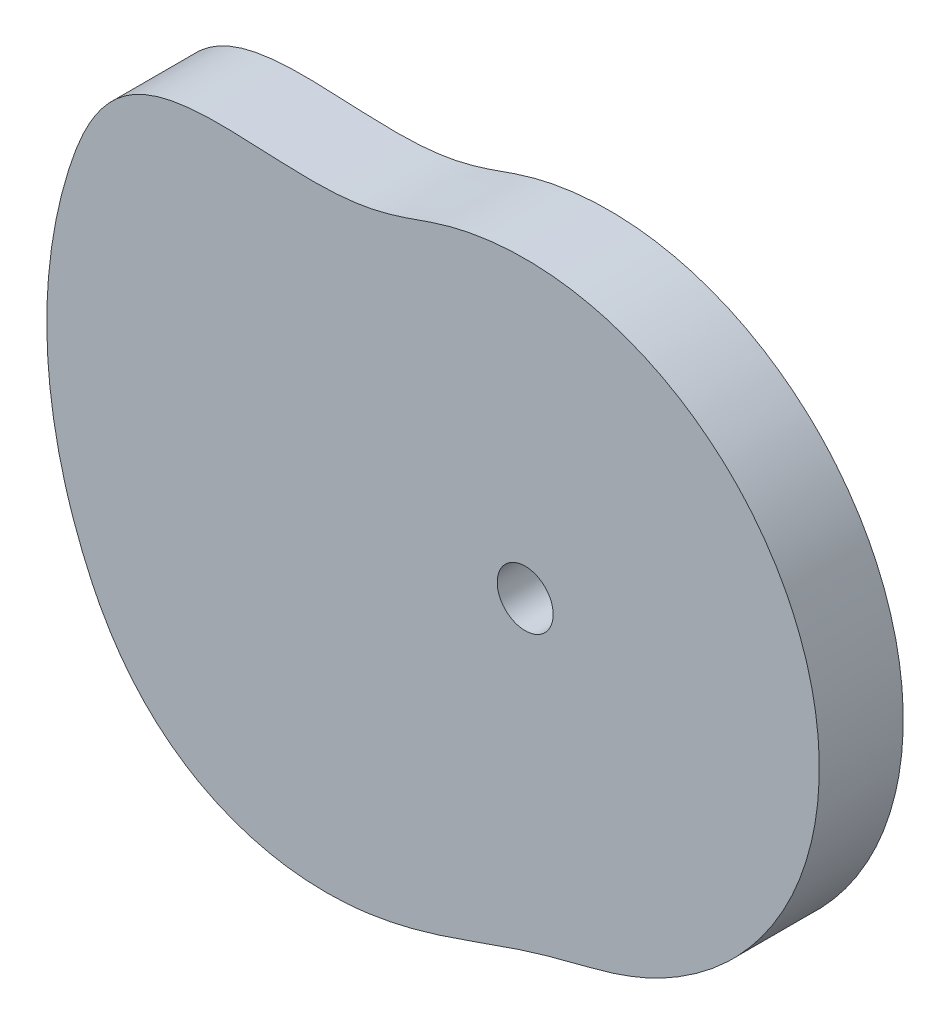
from build123d import *

# Parameters (mm, degrees)
EXTRUDE_1_DEPTH     = 30
SKETCH_2_R          = 10
CUT_EXTRUDE_1_DEPTH = 30


with BuildPart() as part:
    # 草图1 → 凸台-拉伸1 (new body)
    with BuildSketch(Plane.XY):
        with BuildLine():
            add(Edge.make_bspline(
                [(70.35, 78.08), (70.1235491, 78.280265016), (69.665997774, 78.682570689), (68.982412314, 79.289398371), (68.292102593, 79.893029744), (67.588891883, 80.478691495), (66.891717566, 81.072720617), (66.181496931, 81.652705568), (65.459176642, 82.218957625), (64.743004647, 82.790494133), (64.01804335, 83.351779204), (63.291324083, 83.912822246), (62.552523547, 84.4601179), (61.809219345, 84.998915226), (61.0715855, 85.543514417), (60.321667599, 86.069049698), (59.571364355, 86.593553293), (58.809377673, 87.09909109), (58.048095592, 87.612116201), (57.285135355, 88.121242025), (56.507988407, 88.612120666), (55.729281356, 89.098829125), (54.955443387, 89.592177693), (54.167309458, 90.061095985), (53.382581794, 90.53104426), (52.58761119, 90.991635477), (51.792381121, 91.450854376), (50.991804366, 91.899891345), (50.190566729, 92.343904103), (49.37903888, 92.76817937), (48.570838757, 93.204675043), (47.748827061, 93.617695569), (46.935230479, 94.043794382), (46.108915556, 94.437794631), (45.290395219, 94.844441046), (44.456874114, 95.230455735), (43.626772573, 95.620869203), (42.787424456, 95.991755272), (41.94930175, 96.358353036), (41.112163039, 96.736240473), (40.259124813, 97.077928819), (39.412073293, 97.431729794), (38.561840427, 97.77137982), (37.706792076, 98.100279549), (36.854002453, 98.434090717), (35.989554485, 98.738820067), (35.127021824, 99.050923678), (34.263749441, 99.364227648), (33.389415615, 99.648291177), (32.521638137, 99.941603822), (31.648853584, 100.223684253), (30.769363424, 100.487883128), (29.893405573, 100.764841077), (29.009691615, 101.008998847), (28.129648847, 101.258660452), (27.250300213, 101.516774036), (26.35920284, 101.736931047), (25.473003951, 101.975439133), (24.579648825, 102.178615573), (23.686803477, 102.390493025), (22.79561687, 102.603581625), (21.89653694, 102.789430586), (21.001167787, 102.98231536), (20.100828934, 103.160919096), (19.197912593, 103.33352972), (18.292911663, 103.4876295), (17.390981544, 103.652308396), (16.487565833, 103.802320098), (15.580690861, 103.941294768), (14.670774474, 104.072351441), (13.759841721, 104.188802075), (12.850722712, 104.31232647), (11.940548562, 104.421475455), (11.030499112, 104.521379028), (10.117248498, 104.613014207), (9.203173648, 104.688173463), (8.290485676, 104.77249157), (7.377020114, 104.841627407), (6.463659514, 104.902276814), (5.546584453, 104.9482015), (4.630552269, 105.006038959), (3.713240267, 105.027686041), (2.796848064, 105.062613859), (1.880074106, 105.082407798), (0.963328403, 105.087800086), (0.046664522, 105.106155687), (-0.869983848, 105.087507808), (-1.790116339, 105.083745054), (-2.706599831, 105.057600804), (-3.623764543, 105.046282484), (-4.539841905, 104.996483876), (-5.457449364, 104.967682321), (-6.372762096, 104.893697574), (-7.287509723, 104.856556381), (-8.200407894, 104.781171246), (-9.113194762, 104.69853182), (-10.027242858, 104.622918691), (-10.940500687, 104.531404942), (-11.850547885, 104.431467015), (-12.760723846, 104.322334284), (-13.66983786, 104.198779241), (-14.580788792, 104.082435001), (-15.490637331, 103.950982654), (-16.397765186, 103.813482371), (-17.302927761, 103.657548845), (-18.207820528, 103.513455268), (-19.110838419, 103.351191073), (-20.010909103, 103.181381942), (-20.911146301, 103.002191153), (-21.806542359, 102.809462502), (-22.705616408, 102.623576609), (-23.596799773, 102.41048053), (-24.489663895, 102.198669794), (-25.382947184, 101.995234052), (-26.269416046, 101.757701508), (-27.15863919, 101.534122817), (-28.04396715, 101.288942582), (-28.92868566, 101.043680441), (-29.806846958, 100.780579528), (-30.684293071, 100.51986696), (-31.558691703, 100.253110924), (-32.434352394, 99.969759705), (-33.31677594, 99.677041486), (-34.216631567, 99.382949848), (-35.124803612, 99.054626849), (-36.054780709, 98.740838338), (-36.997086637, 98.407847129), (-37.952630509, 98.06800766), (-38.930067034, 97.726857471), (-39.922671745, 97.378098927), (-40.932976269, 97.0289729), (-41.958200984, 96.674682446), (-43.003016412, 96.329028914), (-44.065767622, 95.97727824), (-45.144139376, 95.6253551), (-46.244574416, 95.286418145), (-47.364250227, 94.954870714), (-48.503636243, 94.641159123), (-49.652665429, 94.311655459), (-50.826975094, 94.021262383), (-52.008737323, 93.710752014), (-53.216968242, 93.451221883), (-54.433776674, 93.173165108), (-55.668233756, 92.927388126), (-56.918725226, 92.696267536), (-58.181554304, 92.475936886), (-59.461700787, 92.27551393), (-60.752736062, 92.098920014), (-62.0519496, 91.925482557), (-63.365533898, 91.775956129), (-64.692359191, 91.645772167), (-66.029653842, 91.538705745), (-67.376320938, 91.438853226), (-68.732372312, 91.342450169), (-70.103212576, 91.289703707), (-71.479813096, 91.237780082), (-72.866548173, 91.198895988), (-74.259839905, 91.165442573), (-75.663326141, 91.159170403), (-77.07335572, 91.157809781), (-78.493355558, 91.169702059), (-79.920283959, 91.183625089), (-81.353104473, 91.235971797), (-82.793705134, 91.25308565), (-84.239931927, 91.312374038), (-85.690207173, 91.35756618), (-87.146925885, 91.417673942), (-88.60634889, 91.493784841), (-90.073632638, 91.546594895), (-91.536641249, 91.620594753), (-93.00332265, 91.690218453), (-94.473348871, 91.759632833), (-95.94308858, 91.832195864), (-97.413345552, 91.889771732), (-98.880022297, 91.949380314), (-100.346440199, 92.012693181), (-101.810041739, 92.05894335), (-103.266505991, 92.11130087), (-104.716434191, 92.154955142), (-106.160032491, 92.168297693), (-107.59659747, 92.19176699), (-109.023336966, 92.204280077), (-110.440056875, 92.19109659), (-111.84341195, 92.171485016), (-113.236956104, 92.14380781), (-114.617153653, 92.094137888), (-115.98357305, 92.021050376), (-117.334081037, 91.944663061), (-118.664228942, 91.843989236), (-119.977689917, 91.723645144), (-121.27462726, 91.584450781), (-122.554791935, 91.424275436), (-123.811897294, 91.24572751), (-125.048379863, 91.043361184), (-126.262484875, 90.826320992), (-127.455577427, 90.584012893), (-128.627513957, 90.327653082), (-129.776272744, 90.03439506), (-130.903697096, 89.726345244), (-132.00883842, 89.397363951), (-133.087317257, 89.034788367), (-134.147771347, 88.655328437), (-135.185576718, 88.257281494), (-136.20284184, 87.834288594), (-137.201009372, 87.386372708), (-138.17736094, 86.907744964), (-139.131376176, 86.402080078), (-140.072663145, 85.886304286), (-140.993030276, 85.335547159), (-141.890652289, 84.754371092), (-142.775609832, 84.152729067), (-143.645350318, 83.521661552), (-144.501056955, 82.867270607), (-145.339432495, 82.177853952), (-146.162095011, 81.466840339), (-146.969778413, 80.716929722), (-147.763161627, 79.943173338), (-148.549321727, 79.138672244), (-149.317236856, 78.302288995), (-150.062767631, 77.42852956), (-150.810969479, 76.540847116), (-151.526184112, 75.607126748), (-152.236857214, 74.647413903), (-152.937795007, 73.659927279), (-153.616858245, 72.636600935), (-154.28586005, 71.585808062), (-154.950077249, 70.511799691), (-155.574168396, 69.392291524), (-156.206046161, 68.260238604), (-156.817653452, 67.097293282), (-157.406614444, 65.90480213), (-157.983451948, 64.686535618), (-158.559263727, 63.447093498), (-159.100403323, 62.17826038), (-159.649115168, 60.896480245), (-160.163531906, 59.585972274), (-160.673689741, 58.256015), (-161.177455933, 56.908399041), (-161.648761633, 55.536234141), (-162.137457635, 54.158130419), (-162.593519455, 52.755515498), (-163.040831792, 51.341315906), (-163.483327486, 49.918690675), (-163.909811695, 48.490953045), (-164.336550891, 47.060428382), (-164.726342709, 45.618995355), (-165.137724684, 44.184747098), (-165.498860452, 42.736344994), (-165.871562292, 41.291256019), (-166.233914949, 39.842542297), (-166.569848636, 38.390740691), (-166.90556492, 36.93935966), (-167.210326979, 35.48075316), (-167.513057572, 34.017958683), (-167.80016144, 32.554007292), (-168.082085868, 31.0876959), (-168.354002828, 29.621884599), (-168.600883744, 28.150693269), (-168.84208985, 26.677540826), (-169.073070968, 25.204785593), (-169.282034277, 23.72740213), (-169.480855371, 22.25056345), (-169.674418011, 20.771346378), (-169.840695048, 19.290442638), (-170.002749859, 17.807300867), (-170.150061368, 16.323672177), (-170.295066961, 14.837697511), (-170.410973411, 13.350317297), (-170.521099017, 11.860326383), (-170.624466568, 10.370670007), (-170.700840539, 8.880203183), (-170.772085741, 7.390235384), (-170.830759365, 5.900161476), (-170.884832054, 4.410302771), (-170.909873791, 2.920058087), (-170.935662328, 1.430079892), (-170.927474081, -0.060008571), (-170.934457389, -1.553378624), (-170.914637518, -3.046922389), (-170.867450249, -4.539923318), (-170.835657769, -6.030410618), (-170.769861046, -7.520143554), (-170.704827999, -9.010611603), (-170.610673803, -10.50026518), (-170.51256199, -11.987082803), (-170.40032115, -13.473610586), (-170.284423857, -14.960963462), (-170.141640036, -16.447166373), (-169.990986344, -17.930439472), (-169.834386486, -19.411271513), (-169.650772267, -20.890520426), (-169.462014345, -22.370705213), (-169.260658143, -23.85054383), (-169.055176709, -25.328431133), (-168.820877107, -26.800688181), (-168.581004149, -28.270708787), (-168.334203256, -29.741925653), (-168.060563284, -31.21073481), (-167.783029129, -32.677904073), (-167.490599541, -34.140790037), (-167.193901173, -35.60223867), (-166.872199668, -37.057916831), (-166.540709608, -38.510921782), (-166.203992838, -39.962575471), (-165.84038119, -41.410940145), (-165.473295257, -42.858388153), (-165.090218643, -44.300940892), (-164.704430096, -45.743086417), (-164.289379191, -47.176498166), (-163.883218042, -48.612872549), (-163.455293284, -50.040386678), (-162.997602502, -51.459238909), (-162.554059768, -52.883460006), (-162.082410486, -54.298617169), (-161.599996129, -55.711122966), (-161.11611909, -57.121228748), (-160.597306506, -58.519020344), (-160.094187323, -59.924026583), (-159.560988784, -61.318318553), (-159.026062488, -62.71173006), (-158.45710065, -64.088824657), (-157.905973159, -65.471893222), (-157.319898243, -66.8414014), (-156.733444583, -68.204820115), (-156.141729387, -69.56371359), (-155.534501369, -70.911832025), (-154.902429226, -72.244481888), (-154.272699016, -73.574543203), (-153.621140842, -74.88887929), (-152.967392894, -76.200587934), (-152.278437383, -77.490945022), (-151.594951933, -78.782993713), (-150.880771017, -80.058958265), (-150.167391238, -81.331486334), (-149.417932646, -82.580755497), (-148.677131108, -83.831779608), (-147.898803933, -85.063476444), (-147.116471388, -86.291940304), (-146.301259033, -87.499799209), (-145.482476337, -88.702974324), (-144.643284767, -89.896272411), (-143.771270392, -91.070117247), (-142.89458097, -92.239333506), (-142.002515136, -93.396574495), (-141.080753512, -94.532737404), (-140.1453977, -95.663584374), (-139.177219064, -96.77338349), (-138.207977751, -97.88321614), (-137.200347767, -98.963308031), (-136.180844334, -100.033896437), (-135.143920286, -101.093927598), (-134.080139624, -102.133723061), (-133.002842209, -103.163433174), (-131.902906948, -104.177781067), (-130.769428434, -105.159836104), (-129.632815405, -106.148573485), (-128.462247407, -107.100263322), (-127.281328088, -108.047840882), (-126.07164686, -108.964537857), (-124.838639357, -109.86400878), (-123.59552122, -110.752649853), (-122.329772794, -111.618038155), (-121.037712374, -112.453497526), (-119.735118129, -113.283572392), (-118.408621064, -114.087963377), (-117.061412128, -114.861655258), (-115.702678903, -115.627170957), (-114.319055287, -116.354406584), (-112.919722551, -117.066243107), (-111.500530599, -117.751321083), (-110.074047674, -118.430448871), (-108.617776666, -119.049323429), (-107.160893435, -119.678238924), (-105.682256602, -120.264544229), (-104.1903942, -120.823478717), (-102.687365187, -121.364742991), (-101.176354086, -121.885972058), (-99.646847153, -122.364907302), (-98.109395204, -122.822561727), (-96.562614013, -123.268663708), (-94.999039516, -123.663078213), (-93.43193939, -124.041322626), (-91.861607001, -124.409635445), (-90.281337944, -124.720194527), (-88.696713628, -125.02886422), (-87.104318609, -125.289321108), (-85.510038065, -125.549922967), (-83.910983885, -125.751579641), (-82.31112629, -125.943138366), (-80.71147429, -126.115076668), (-79.107898003, -126.256042155), (-77.503853337, -126.361791324), (-75.900754558, -126.455308899), (-74.303748933, -126.51645876), (-72.706725469, -126.538226901), (-71.113332828, -126.570907904), (-69.523272645, -126.538276856), (-67.939585058, -126.516442911), (-66.362527116, -126.45605407), (-64.79309368, -126.360509284), (-63.229314213, -126.26339583), (-61.671943007, -126.14606059), (-60.122189141, -125.994068214), (-58.582960522, -125.820166891), (-57.051017856, -125.648086281), (-55.532837286, -125.430028824), (-54.024798651, -125.215677355), (-52.528292286, -124.973354188), (-51.042581095, -124.710977964), (-49.564096717, -124.446775601), (-48.099489051, -124.149221874), (-46.643638101, -123.857485448), (-45.206734563, -123.529669885), (-43.777385126, -123.21461612), (-42.365310716, -122.872223858), (-40.960068768, -122.52595367), (-39.573622373, -122.14890876), (-38.194094121, -121.78605798), (-36.833672324, -121.398817674), (-35.479488044, -121.026599911), (-34.143565968, -120.619185579), (-32.81106181, -120.224116162), (-31.496138021, -119.811682269), (-30.191059188, -119.403768409), (-28.903086869, -118.980739135), (-27.622727134, -118.561841311), (-26.353067885, -118.140810041), (-25.091011197, -117.723531438), (-23.84568917, -117.29279943), (-22.609848729, -116.860439831), (-21.384862044, -116.428930531), (-20.160705233, -116.014190742), (-18.952812747, -115.581439335), (-17.754656678, -115.149617185), (-16.562562475, -114.732171933), (-15.379847898, -114.310430056), (-14.205008207, -113.888600375), (-13.030123755, -113.485683461), (-11.876879444, -113.056680902), (-10.71966463, -112.660935235), (-9.572517157, -112.262349138), (-8.432077882, -111.85733443), (-7.292342625, -111.472873068), (-6.164457783, -111.080070018), (-5.041822133, -110.697872175), (-3.922297574, -110.33312683), (-2.811996938, -109.957263238), (-1.699634248, -109.601114503), (-0.594443381, -109.239898904), (0.505490021, -108.889571665), (1.600561076, -108.551840225), (2.683384554, -108.205860728), (3.772460513, -107.894845312), (4.843420061, -107.555767049), (5.920596318, -107.25202161), (6.985334364, -106.938693584), (8.050329258, -106.641158857), (9.10542933, -106.338911434), (10.16026178, -106.050940876), (11.205618128, -105.759506075), (12.245695599, -105.479663013), (13.28005521, -105.210210685), (14.307019459, -104.941338545), (15.330047747, -104.67018307), (16.342624875, -104.400631459), (17.353187867, -104.139438953), (18.352379003, -103.879602147), (19.351799261, -103.63364814), (20.335064707, -103.367151955), (21.31889977, -103.125209636), (22.285334634, -102.858274594), (23.249910758, -102.609681097), (24.208789836, -102.364602396), (25.155040774, -102.097312578), (26.098889849, -101.854817987), (27.026556447, -101.589602225), (27.951901339, -101.333255556), (28.861929016, -101.058556101), (29.77380329, -100.806007282), (30.664667778, -100.516798719), (31.556330061, -100.256301651), (32.434109378, -99.968973809), (33.304067503, -99.682274823), (34.176639288, -99.392830689), (35.034624707, -99.077545322), (35.903937134, -98.784315278), (36.761601941, -98.460815458), (37.61947571, -98.128680359), (38.479827448, -97.804702921), (39.328916891, -97.457338022), (40.182265106, -97.126850581), (41.021411001, -96.755434991), (41.869733688, -96.403833826), (42.709766719, -96.03351518), (43.541678658, -95.646365657), (44.37983942, -95.273595898), (45.209932831, -94.883433797), (46.029073197, -94.478128415), (46.855060172, -94.083462029), (47.669354818, -93.658698731), (48.487524304, -93.241709487), (49.304861823, -92.822479023), (50.107149629, -92.380868667), (50.912743862, -91.941600868), (51.709215887, -91.488609445), (52.510719269, -91.043760703), (53.301843765, -90.579784699), (54.092510888, -90.110837306), (54.877441019, -89.631285277), (55.661291864, -89.154041589), (56.428693484, -88.65796106), (57.206126504, -88.172765798), (57.964281833, -87.659714593), (58.735900881, -87.16214712), (59.48759208, -86.641312772), (60.242551355, -86.120330044), (60.9924934, -85.590146689), (61.737872522, -85.051681642), (62.48171442, -84.513468136), (63.209193762, -83.958916846), (63.942575212, -83.410075368), (64.671306019, -82.852613458), (65.392228671, -82.279448269), (66.108678119, -81.702481069), (66.818612986, -81.122367578), (67.522594619, -80.539768901), (68.222155464, -79.949209678), (68.92169136, -79.352446907), (69.609139544, -78.742749114), (70.288526103, -78.12839779), (70.976453576, -77.523972851), (71.634599345, -76.887544321), (72.316597058, -76.273829906), (72.968340493, -75.628254526), (73.629859404, -74.993279099), (74.281937568, -74.348623595), (74.93239403, -73.702307352), (75.568726249, -73.041975399), (76.203191486, -72.379683342), (76.82854229, -71.708648359), (77.462868733, -71.045437998), (78.07189243, -70.358316926), (78.67974441, -69.669779719), (79.289319365, -68.982342318), (79.893050878, -68.292121316), (80.478685829, -67.588886864), (81.072722137, -66.891718913), (81.65270516, -66.181496569), (82.218957734, -65.459176739), (82.790494103, -64.743004621), (83.351779212, -64.018043357), (83.912822244, -63.291324081), (84.460117901, -62.552523548), (84.998915226, -61.809219345), (85.543514417, -61.0715855), (86.069049698, -60.321667599), (86.593553293, -59.571364355), (87.09909109, -58.809377673), (87.612116201, -58.048095592), (88.121242025, -57.285135355), (88.612120666, -56.507988407), (89.098829125, -55.729281356), (89.592177693, -54.955443387), (90.061095985, -54.167309458), (90.53104426, -53.382581794), (90.991635477, -52.58761119), (91.450854376, -51.792381121), (91.899891345, -50.991804366), (92.343904103, -50.190566729), (92.76817937, -49.37903888), (93.204675043, -48.570838757), (93.617695569, -47.748827061), (94.043794382, -46.935230479), (94.437794631, -46.108915556), (94.844441045, -45.290395218), (95.230455738, -44.456874115), (95.620869192, -43.626772569), (95.991755311, -42.78742447), (96.358352889, -41.949301697), (96.73624102, -41.112163235), (97.077926776, -40.25912408), (97.431737403, -39.412076021), (97.771351599, -38.561830311), (98.100384871, -37.706829828), (98.433694388, -36.853860391), (98.741335961, -35.9871226), (99.046467594, -35.122091567), (99.366690311, -34.261299573), (99.647890968, -33.389272233), (99.941709112, -32.521675981), (100.223661503, -31.648844948), (100.48786798, -30.769359836), (100.764924234, -29.893428522), (101.008683537, -29.009604015), (101.260720025, -28.126892141), (101.513245444, -27.2460086), (101.738920809, -26.356392349), (101.975131088, -25.472922304), (102.178697904, -24.579670647), (102.390470692, -23.686797558), (102.603587532, -22.795618435), (102.789428994, -21.896536518), (102.982315787, -21.001167901), (103.160918982, -20.100828904), (103.333529751, -19.197912601), (103.487629491, -18.292911661), (103.652308398, -17.390981544), (103.802320097, -16.487565833), (103.941294768, -15.580690861), (104.072351441, -14.670774474), (104.188802075, -13.759841721), (104.31232647, -12.850722712), (104.421475455, -11.940548562), (104.521379028, -11.030499112), (104.613014207, -10.117248498), (104.688173463, -9.203173648), (104.77249157, -8.290485676), (104.841627407, -7.377020114), (104.902276814, -6.463659514), (104.9482015, -5.546584453), (105.006038959, -4.630552269), (105.027686041, -3.713240267), (105.062613859, -2.796848064), (105.082407798, -1.880074106), (105.087800086, -0.963328403), (105.106155687, -0.046664522), (105.087507808, 0.869983848), (105.083745054, 1.790116339), (105.057600804, 2.706599831), (105.046282484, 3.623764543), (104.996483876, 4.539841905), (104.967682321, 5.457449364), (104.893697574, 6.372762096), (104.856556381, 7.287509723), (104.781171246, 8.200407894), (104.69853182, 9.113194762), (104.622918691, 10.027242858), (104.531404942, 10.940500687), (104.431467015, 11.850547885), (104.322334284, 12.760723846), (104.198779241, 13.66983786), (104.082435001, 14.580788792), (103.950982654, 15.490637331), (103.813482371, 16.397765186), (103.657548845, 17.302927761), (103.513455268, 18.207820528), (103.351191073, 19.110838419), (103.181381942, 20.010909103), (103.002191153, 20.911146301), (102.809462502, 21.806542359), (102.623576609, 22.705616408), (102.41048053, 23.596799772), (102.198669796, 24.489663895), (101.995234046, 25.382947182), (101.757701528, 26.269416052), (101.534122741, 27.158639166), (101.288942863, 28.043967241), (101.04367938, 28.928685315), (100.780583435, 29.806848229), (100.519852461, 30.684288354), (100.253165718, 31.558709527), (99.969555735, 32.434286042), (99.68212165, 33.304021002), (99.39287219, 34.176651888), (99.077534295, 35.034621359), (98.78431824, 35.903938033), (98.460814659, 36.761601698), (98.128680574, 37.619475775), (97.804702863, 38.47982743), (97.457338037, 39.328916895), (97.126850577, 40.182265105), (96.755434992, 41.021411002), (96.403833825, 41.869733688), (96.03351518, 42.709766719), (95.646365657, 43.541678658), (95.273595898, 44.37983942), (94.883433797, 45.209932831), (94.478128415, 46.029073197), (94.083462029, 46.855060172), (93.658698731, 47.669354818), (93.241709487, 48.487524304), (92.822479023, 49.304861823), (92.380868667, 50.107149629), (91.941600868, 50.912743862), (91.488609445, 51.709215887), (91.043760703, 52.510719269), (90.579784699, 53.301843765), (90.110837306, 54.092510888), (89.631285277, 54.877441019), (89.154041589, 55.661291864), (88.65796106, 56.428693484), (88.172765798, 57.206126504), (87.659714593, 57.964281833), (87.16214712, 58.735900881), (86.641312772, 59.48759208), (86.120330044, 60.242551355), (85.590146689, 60.9924934), (85.051681642, 61.737872522), (84.513468136, 62.48171442), (83.958916846, 63.209193762), (83.410075368, 63.942575212), (82.852613458, 64.671306019), (82.279448269, 65.392228671), (81.702481069, 66.108678119), (81.122367578, 66.818612986), (80.539768901, 67.522594619), (79.949209678, 68.222155464), (79.352446907, 68.92169136), (78.742749114, 69.609139544), (78.12839779, 70.288526103), (77.52397285, 70.976453575), (76.887544323, 71.634599347), (76.273829899, 72.31659705), (75.628254553, 72.968340524), (74.993278998, 73.629859292), (74.34862397, 74.281937986), (73.702305941, 74.932392457), (73.041980647, 75.568732101), (72.379663856, 76.203169758), (71.708721743, 76.828624121), (71.041761038, 77.465816277), (70.581637003, 77.875148581), (70.35, 78.08)],
                knots=[0, 0, 0, 0, 0.001102643, 0.002222449, 0.003334239, 0.004447358, 0.005560476, 0.006675188, 0.007791754, 0.008908321, 0.010017381, 0.011136064, 0.012257124, 0.013370972, 0.014484821, 0.015601454, 0.016711114, 0.017823967, 0.01893682, 0.02005979, 0.021169517, 0.022289521, 0.023409525, 0.024516784, 0.025634475, 0.026745999, 0.027868047, 0.028984084, 0.03009421, 0.031209253, 0.032324296, 0.033444498, 0.034564699, 0.035674026, 0.036783353, 0.037898396, 0.039024456, 0.040129376, 0.041245413, 0.04236145, 0.043479141, 0.044596832, 0.045709951, 0.046818612, 0.047938615, 0.049050139, 0.050161663, 0.051284633, 0.052399676, 0.053514718, 0.054625976, 0.055745188, 0.056864399, 0.057976721, 0.059089042, 0.060201364, 0.061319055, 0.062436747, 0.063548603, 0.064660459, 0.065784153, 0.066890678, 0.068009096, 0.069125067, 0.070238717, 0.071362147, 0.072473604, 0.073582998, 0.074702474, 0.075820165, 0.076936202, 0.078052239, 0.079166751, 0.08027987, 0.081391726, 0.082514564, 0.08362529, 0.084735016, 0.08585601, 0.086964137, 0.088084405, 0.089203616, 0.090310675, 0.091429556, 0.092548239, 0.093654764, 0.094773447, 0.09589213, 0.097011011, 0.098117737, 0.09923741, 0.100357084, 0.101465945, 0.102586212, 0.103695939, 0.104806665, 0.105929503, 0.107041359, 0.108154478, 0.10926899, 0.110385027, 0.111501064, 0.112618755, 0.113738231, 0.114847624, 0.115969013, 0.117080471, 0.11819412, 0.119310091, 0.12042851, 0.121535035, 0.122658728, 0.123770584, 0.124882441, 0.126000132, 0.127117823, 0.128226884, 0.129350906, 0.130466612, 0.131570662, 0.132689874, 0.133801132, 0.134927716, 0.136081209, 0.137254084, 0.138449927, 0.139661246, 0.140899543, 0.142149308, 0.143437518, 0.144737211, 0.146048398, 0.14739414, 0.148751422, 0.150131816, 0.151531725, 0.152951401, 0.154391086, 0.155842482, 0.157311091, 0.158803269, 0.160298811, 0.161818087, 0.163356125, 0.164889543, 0.166456718, 0.168031938, 0.16961563, 0.171209742, 0.172812963, 0.1744378, 0.176072571, 0.177706391, 0.179363616, 0.181030979, 0.182710005, 0.184388635, 0.186091269, 0.187793556, 0.189507958, 0.191234562, 0.192973451, 0.194712851, 0.19646411, 0.198228195, 0.199992281, 0.201756827, 0.203546208, 0.205322902, 0.207112283, 0.208889519, 0.210678899, 0.212480425, 0.21425712, 0.216045964, 0.217834807, 0.219611044, 0.221387281, 0.22315099, 0.224902037, 0.226653085, 0.228391847, 0.230106292, 0.231820867, 0.233511345, 0.235190371, 0.23685831, 0.238502639, 0.240124334, 0.241723816, 0.24331361, 0.244882059, 0.246429631, 0.247944815, 0.249452124, 0.250928164, 0.252385455, 0.2538275, 0.255252218, 0.256648585, 0.258032776, 0.259401933, 0.260756761, 0.262086756, 0.263420081, 0.264746904, 0.266052215, 0.267358376, 0.268661646, 0.269963499, 0.271258519, 0.272564566, 0.273882669, 0.275187301, 0.276523285, 0.277848324, 0.279206857, 0.280565391, 0.281950917, 0.283347548, 0.284754883, 0.286184934, 0.287636737, 0.289110973, 0.290601515, 0.292115967, 0.293654918, 0.295206783, 0.296790474, 0.29838403, 0.299999011, 0.301641495, 0.30330086, 0.304983624, 0.306672789, 0.308386501, 0.310118448, 0.311868863, 0.313633912, 0.31541044, 0.317202215, 0.319013398, 0.320820946, 0.322636572, 0.324448735, 0.326265908, 0.328083081, 0.329890833, 0.331710363, 0.333526926, 0.335337783, 0.337145903, 0.338960674, 0.340772959, 0.342594763, 0.344402311, 0.346219565, 0.348032584, 0.349843604, 0.351664719, 0.35347022, 0.355286091, 0.357100373, 0.35891172, 0.36072172, 0.36254255, 0.364350097, 0.366167636, 0.36798424, 0.369799988, 0.371614271, 0.373427942, 0.375241083, 0.377053776, 0.378865816, 0.380677653, 0.382489326, 0.384300999, 0.386124993, 0.387937319, 0.389749644, 0.391562786, 0.393376457, 0.395191432, 0.397007181, 0.398811658, 0.400629197, 0.40244885, 0.404257583, 0.406067582, 0.407880357, 0.409694639, 0.41151051, 0.413328049, 0.41513715, 0.41694817, 0.418761189, 0.420578443, 0.422397933, 0.42420781, 0.426020095, 0.427837431, 0.429645551, 0.431456407, 0.43327297, 0.435092501, 0.436903317, 0.438717273, 0.440537738, 0.442346512, 0.444162139, 0.445973322, 0.447784505, 0.449603183, 0.451414203, 0.453229178, 0.455040851, 0.456852524, 0.458672664, 0.460485805, 0.462296621, 0.464107438, 0.465916334, 0.467730005, 0.469521368, 0.471322606, 0.473122983, 0.474901383, 0.476690391, 0.478473938, 0.480247009, 0.482025783, 0.483805513, 0.485580584, 0.487346805, 0.489119251, 0.490883672, 0.492661116, 0.494431559, 0.496198742, 0.497969811, 0.499752363, 0.501532425, 0.503300528, 0.50508171, 0.5068689, 0.508653275, 0.510453652, 0.512243281, 0.514040699, 0.515846282, 0.517651865, 0.519466474, 0.521282222, 0.523108889, 0.52493677, 0.526776943, 0.528611282, 0.530459472, 0.532312614, 0.534178359, 0.536033216, 0.537904933, 0.53979054, 0.541667266, 0.543562998, 0.545457288, 0.547355515, 0.549264149, 0.551183751, 0.553103853, 0.55502611, 0.55695474, 0.558891974, 0.560827376, 0.562765793, 0.564719101, 0.566657212, 0.568611428, 0.570570518, 0.572528664, 0.574492727, 0.576451213, 0.578411321, 0.580366747, 0.582339673, 0.584296686, 0.586258792, 0.588217881, 0.590174252, 0.592127106, 0.594089249, 0.596037745, 0.597984533, 0.599918139, 0.601863712, 0.603797127, 0.605718576, 0.607641064, 0.609553142, 0.61145382, 0.613356209, 0.61524964, 0.617133482, 0.61900662, 0.620872325, 0.6227277, 0.624562724, 0.626401772, 0.628230986, 0.630040863, 0.631853148, 0.633646738, 0.635416596, 0.637191959, 0.638946591, 0.640695527, 0.642432715, 0.644149659, 0.645854896, 0.647555228, 0.649243912, 0.650924522, 0.652581925, 0.65423146, 0.655869438, 0.657495867, 0.659110756, 0.66071803, 0.662302327, 0.663886625, 0.665455451, 0.667016814, 0.668566725, 0.670101106, 0.671624027, 0.673146948, 0.674654355, 0.676154388, 0.677634829, 0.679115269, 0.680584231, 0.682049212, 0.683502694, 0.684940735, 0.686374916, 0.687797557, 0.6892164, 0.690635242, 0.69203879, 0.693427087, 0.694815384, 0.696184973, 0.697558065, 0.698912567, 0.700267068, 0.701606533, 0.702945998, 0.704270479, 0.70559496, 0.706904511, 0.708199189, 0.709493867, 0.710776788, 0.712059708, 0.713316021, 0.714584105, 0.715825621, 0.71707017, 0.718299901, 0.719520946, 0.720727129, 0.721933312, 0.723130884, 0.72431355, 0.725487685, 0.726650115, 0.72781591, 0.728954957, 0.730100992, 0.731231833, 0.732343091, 0.733469675, 0.73457319, 0.73569616, 0.73680362, 0.737919325, 0.739039329, 0.740159333, 0.741272451, 0.74238557, 0.743496761, 0.744619139, 0.745735175, 0.746845102, 0.747966095, 0.749081138, 0.750190465, 0.751299792, 0.752419994, 0.753540196, 0.754649589, 0.755770385, 0.756880511, 0.757996548, 0.759112585, 0.760224109, 0.7613418, 0.762465757, 0.76357934, 0.764689067, 0.765798794, 0.766921763, 0.768027887, 0.769147561, 0.770257221, 0.771373854, 0.772497548, 0.773611397, 0.774722721, 0.775834045, 0.776952728, 0.778069295, 0.779193449, 0.78030816, 0.781413482, 0.782526601, 0.783647594, 0.7847674, 0.785878125, 0.786988851, 0.788107071, 0.789216997, 0.790334821, 0.791452645, 0.792561772, 0.793679463, 0.794797287, 0.795906681, 0.797024901, 0.798143121, 0.799253847, 0.800373653, 0.801493458, 0.802605248, 0.803718367, 0.804831486, 0.805946197, 0.807062763, 0.80817933, 0.80928839, 0.810407073, 0.811528133, 0.812641982, 0.813755831, 0.814872463, 0.815982124, 0.817094977, 0.81820783, 0.819330799, 0.820440526, 0.82156053, 0.822680534, 0.823787793, 0.824905485, 0.826017008, 0.827139056, 0.828255093, 0.829365219, 0.830480262, 0.831595305, 0.832715507, 0.833835709, 0.834945036, 0.836054363, 0.837169405, 0.838295465, 0.839400385, 0.840516422, 0.841632459, 0.84275015, 0.843867842, 0.84498096, 0.846089621, 0.847209625, 0.848321148, 0.849444118, 0.850555642, 0.851670685, 0.852785728, 0.853896985, 0.855016197, 0.856135408, 0.85724773, 0.858360051, 0.859484074, 0.860589997, 0.861707689, 0.862819545, 0.863931401, 0.865055095, 0.86616162, 0.867280039, 0.868396009, 0.869509659, 0.870633089, 0.871744547, 0.87285394, 0.873973416, 0.875091107, 0.876207144, 0.877323181, 0.878437693, 0.879550812, 0.880662668, 0.881785506, 0.882896232, 0.884005959, 0.885126952, 0.886235079, 0.887355347, 0.888474558, 0.889581617, 0.890700499, 0.891819182, 0.892925706, 0.894044389, 0.895163072, 0.896281954, 0.897388679, 0.898508353, 0.899628026, 0.900736887, 0.901857155, 0.902966881, 0.904077607, 0.905200445, 0.906312301, 0.90742542, 0.908539932, 0.909655969, 0.910772006, 0.911889697, 0.913009173, 0.914118567, 0.915239956, 0.916351413, 0.917465063, 0.918581033, 0.919699452, 0.920805977, 0.92192967, 0.923041527, 0.924153383, 0.925271074, 0.926388766, 0.927497826, 0.928621849, 0.929737554, 0.930841605, 0.931960816, 0.933072074, 0.934198658, 0.935302173, 0.936425143, 0.937532602, 0.938648308, 0.939768312, 0.940888315, 0.942001434, 0.943114553, 0.944225744, 0.945348121, 0.946464158, 0.947574085, 0.948695078, 0.949810121, 0.950919448, 0.952028775, 0.953148977, 0.954269178, 0.955378572, 0.956499368, 0.957609494, 0.958725531, 0.959841567, 0.960953091, 0.962070783, 0.963194739, 0.964308323, 0.96541805, 0.966527776, 0.967650746, 0.96875687, 0.969876544, 0.970986204, 0.972102837, 0.97322653, 0.974340379, 0.975451704, 0.976563028, 0.977681711, 0.978798277, 0.979922431, 0.981037143, 0.982142465, 0.983255583, 0.984376577, 0.985496382, 0.986607108, 0.987717833, 0.988836054, 0.98994598, 0.991063804, 0.992181628, 0.993290755, 0.994408446, 0.99552627, 0.996635663, 0.997753884, 0.998872104, 1, 1, 1, 1], degree=3))
        make_face()
    extrude(amount=EXTRUDE_1_DEPTH)

    # 草图2 → 切除-拉伸1 (cut)
    with BuildSketch(Plane.XY):
        Circle(SKETCH_2_R)
    extrude(amount=CUT_EXTRUDE_1_DEPTH, mode=Mode.SUBTRACT)


solid = part.part
